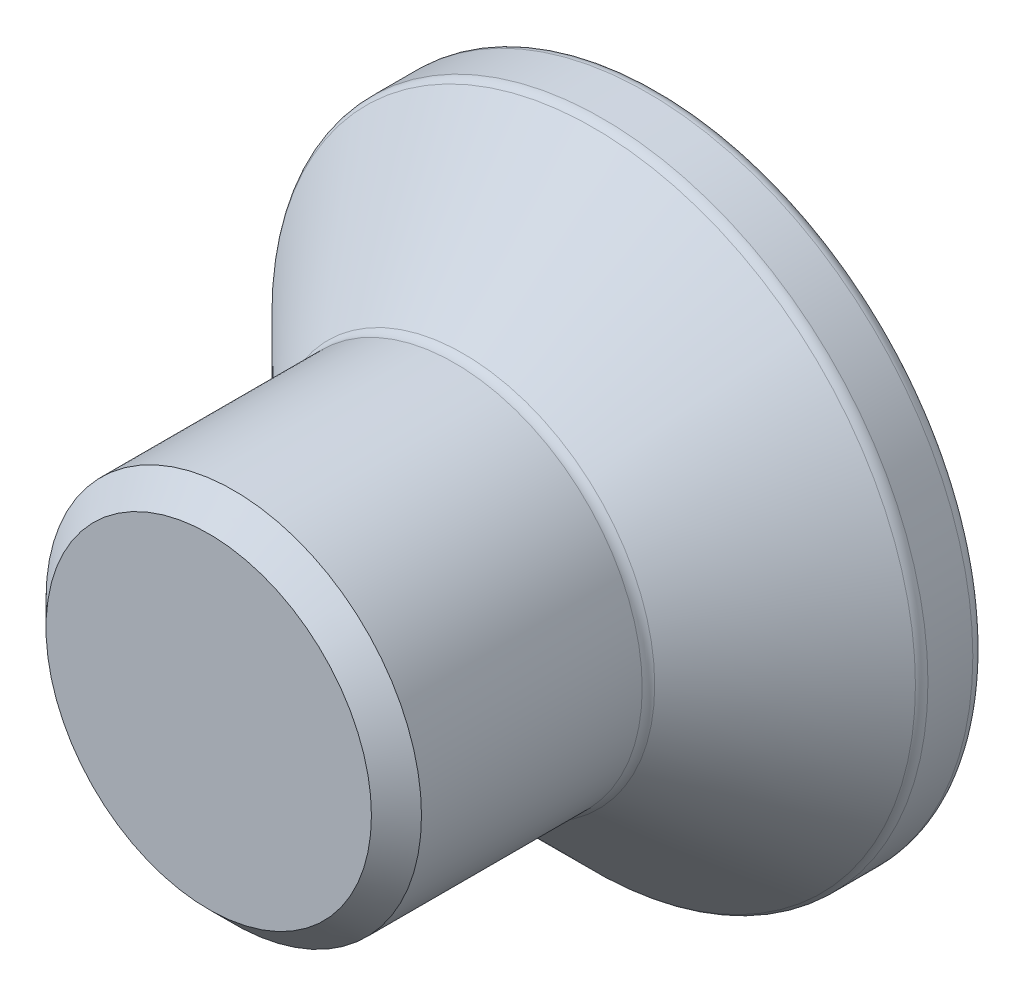
from build123d import *

# Parameters (mm, degrees)
CUT_EXTRUDE1_DEPTH = 1
CHAMFER1_SIZE      = 0.5
FILLET1_R          = 0.1
CHAMFER2_SIZE      = 0.2


with BuildPart() as part:
    # Sketch1 → Revolve1 (revolve)
    with BuildSketch(Plane(origin=(0, 0, 0), x_dir=(1, 0, 0), z_dir=(0, 1, 0))):
        Polygon((0, 3.604974233), (2.6, 3.604974233), (2.6, 3.104974233), (1.5, 2.004974233), (1.5, 0), (0, 0), align=None)
    revolve(axis=Axis((0, 0, 0), (0, 0, -1)))

    # Sketch2 → Cut-Extrude1 (cut)
    with BuildSketch(Plane(origin=(0, 0, -3.604974233), x_dir=(-1, 0, 0), z_dir=(0, 0, -1))):
        Polygon((1.5, 0), (0.75, 1.299038106), (-0.75, 1.299038106), (-1.5, 0), (-0.75, -1.299038106), (0.75, -1.299038106), align=None)
    extrude(amount=-CUT_EXTRUDE1_DEPTH, mode=Mode.SUBTRACT)

    # Chamfer1
    chamfer1_edges = [part.edges().sort_by_distance(p)[0] for p in [
        (-1.125, -0.649519053, -2.604974233),
        (0, -1.299038106, -2.604974233),
        (1.125, -0.649519053, -2.604974233),
        (1.125, 0.649519053, -2.604974233),
        (0, 1.299038106, -2.604974233),
        (-1.125, 0.649519053, -2.604974233),
    ]]
    chamfer(chamfer1_edges, length=CHAMFER1_SIZE)

    # Fillet1
    fillet1_edges = [part.edges().sort_by_distance(p)[0] for p in [
        (-1.5, 0, -2.004974233),
        (-2.6, 0, -3.104974233),
        (-2.6, 0, -3.604974233),
    ]]
    fillet(fillet1_edges, radius=FILLET1_R)

    # Chamfer2
    chamfer2_edges = [part.edges().sort_by_distance(p)[0] for p in [
        (-1.5, 0, 0),
    ]]
    chamfer(chamfer2_edges, length=CHAMFER2_SIZE)


solid = part.part
